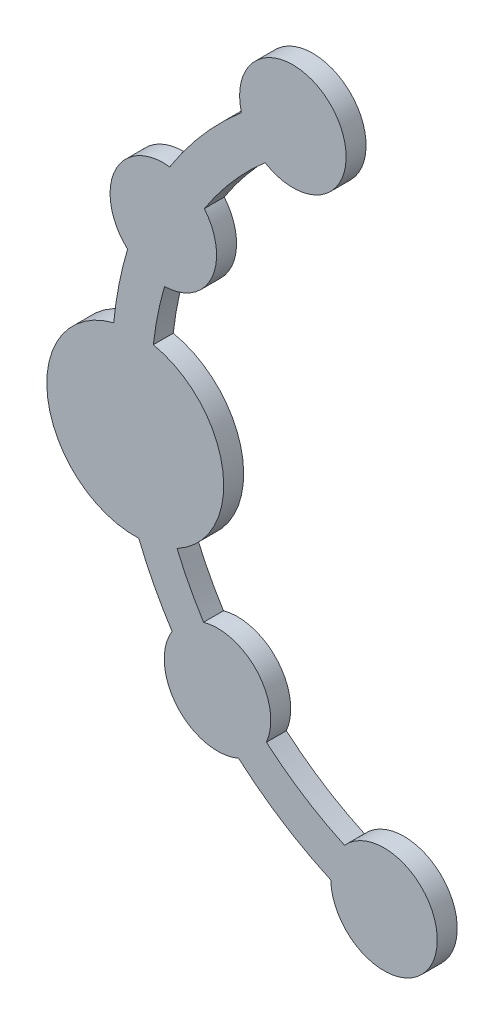
from build123d import *

# Parameters (mm, degrees)
PADS_SKETCH_R   = 5.42
PADS_DEPTH      = 2.03
PADS_2_DEPTH    = 2.03
PADS_3_DEPTH    = 2.03
PADS_4_DEPTH    = 2.03
PADS_SKETCH_R_2 = 9
PADS_5_DEPTH    = 2.03
CONNECTOR_DEPTH = 2.03


with BuildPart() as part:
    # Pads Sketch → Pads (new body)
    with BuildSketch(Plane.XY):
        with Locations((-10.069761866, -34.302512969)):
            Circle(PADS_SKETCH_R)
    extrude(amount=PADS_DEPTH)



with BuildPart() as body_2:
    # Pads Sketch → Pads 2 (new body)
    with BuildSketch(Plane.XY):
        with Locations((-27.013589298, -23.416415038)):
            Circle(PADS_SKETCH_R)
    extrude(amount=PADS_2_DEPTH)


with BuildPart() as body_3:
    # Pads Sketch → Pads 3 (new body)
    with BuildSketch(Plane.XY):
        with Locations((-32.525938452, 14.836638023)):
            Circle(PADS_SKETCH_R)
    extrude(amount=PADS_3_DEPTH)


with BuildPart() as body_4:
    # Pads Sketch → Pads 4 (new body)
    with BuildSketch(Plane.XY):
        with Locations((-19.345084764, 30.063768817)):
            Circle(PADS_SKETCH_R)
    extrude(amount=PADS_4_DEPTH)


with BuildPart() as body_5:
    # Pads Sketch → Pads 5 (new body)
    with BuildSketch(Plane.XY):
        with Locations((-35.384500255, -5.09898438)):
            Circle(PADS_SKETCH_R_2)
    extrude(amount=PADS_5_DEPTH)


with BuildPart() as part_1:
    add(part.part)

    add(body_2.part)  # Connector merges body 2

    add(body_3.part)  # Connector merges body 3

    add(body_4.part)  # Connector merges body 4

    add(body_5.part)  # Connector merges body 5
    # Connector Sketch → Connector (add)
    with BuildSketch(Plane.XY.offset(2.03)):
        with BuildLine():
            Line((-24.578173622, 28.652676688), (-22.176010765, 25.44183654))
            ThreePointArc((-22.176010765, 25.44183654), (-33.404947793, -4.813726513), (-14.090471833, -30.667916517))
            Line((-14.090471833, -30.667916517), (-15.488346946, -34.426350502))
            ThreePointArc((-15.488346946, -34.426350502), (-37.364052717, -5.384242247), (-24.578173622, 28.652676688))
        make_face()
    extrude(amount=-CONNECTOR_DEPTH)


solid = part_1.part
